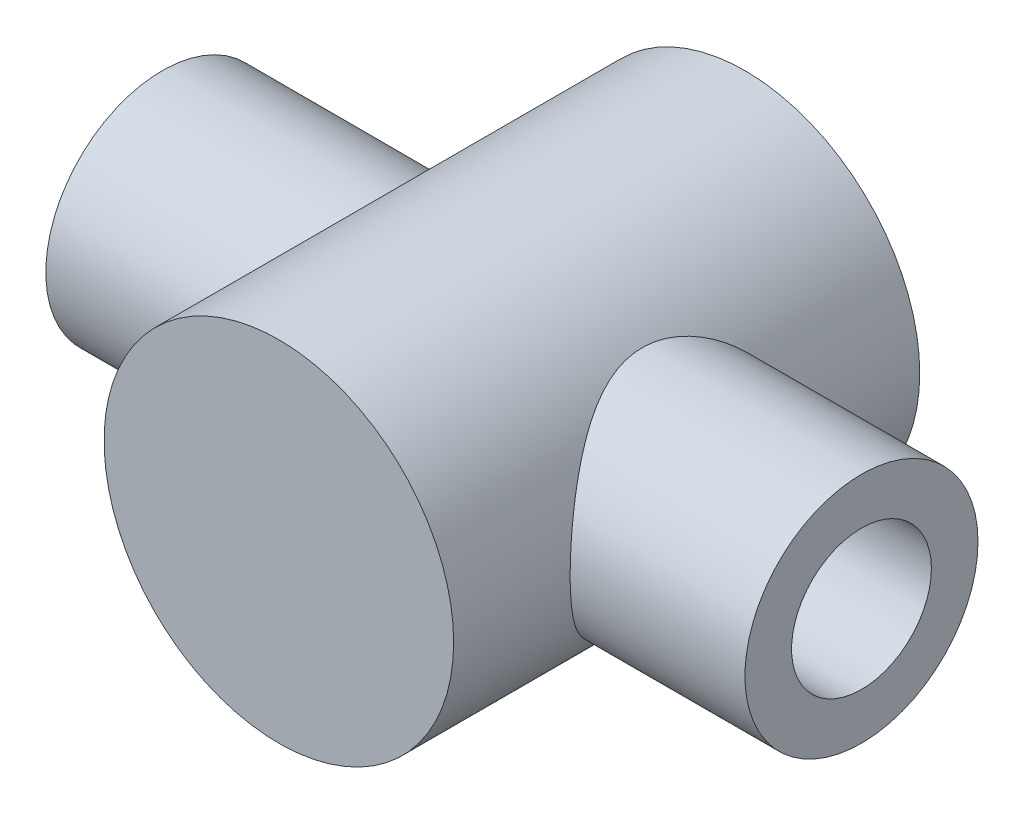
from build123d import *

# Parameters (mm, degrees)
SKETCH3_R                = 15
BOSS_EXTRUDE2_DEPTH      = 40
BOSS_EXTRUDE3_DEPTH      = 30
BOSS_EXTRUDE3_DEPTH_BACK = 30
SKETCH4_R                = 10
SKETCH5_OUTSIDE_W        = 57.62
SKETCH5_OUTSIDE_H        = 47.62
SKETCH5_OUTSIDE_R        = 10
SKETCH5_OUTSIDE_R_2      = 6
CUT_EXTRUDE2_DEPTH       = 10


with BuildPart() as part:
    # Sketch3 → Boss-Extrude2 (new body)
    with BuildSketch(Plane.XY):
        Circle(SKETCH3_R)
    extrude(amount=BOSS_EXTRUDE2_DEPTH)

    # Sketch4 → Boss-Extrude3 (add, two sides: drawn at the far end of the back side and taken through both)
    with BuildSketch(Plane(origin=(0, 0, 0), x_dir=(0, 0, -1), z_dir=(1, 0, 0)).offset(-BOSS_EXTRUDE3_DEPTH_BACK)):
        with Locations((-20, 0)):
            Circle(SKETCH4_R)
    extrude(amount=BOSS_EXTRUDE3_DEPTH + BOSS_EXTRUDE3_DEPTH_BACK)

    # Sketch5 outside → Cut-Extrude2 (cut)
    # profile 1 of 2: a face of its own
    with BuildSketch(Plane(origin=(30, 0, 0), x_dir=(0, 0, -1), z_dir=(1, 0, 0))):
        with Locations((-20, 0)):
            Rectangle(SKETCH5_OUTSIDE_W, SKETCH5_OUTSIDE_H)
        with Locations((-20, 0)):
            Circle(SKETCH5_OUTSIDE_R, mode=Mode.SUBTRACT)
    # profile 2 of 2: a face of its own
    with BuildSketch(Plane(origin=(30, 0, 0), x_dir=(0, 0, -1), z_dir=(1, 0, 0))):
        with Locations((-20, 0)):
            Circle(SKETCH5_OUTSIDE_R_2)
    extrude(amount=-CUT_EXTRUDE2_DEPTH, mode=Mode.SUBTRACT)


solid = part.part
